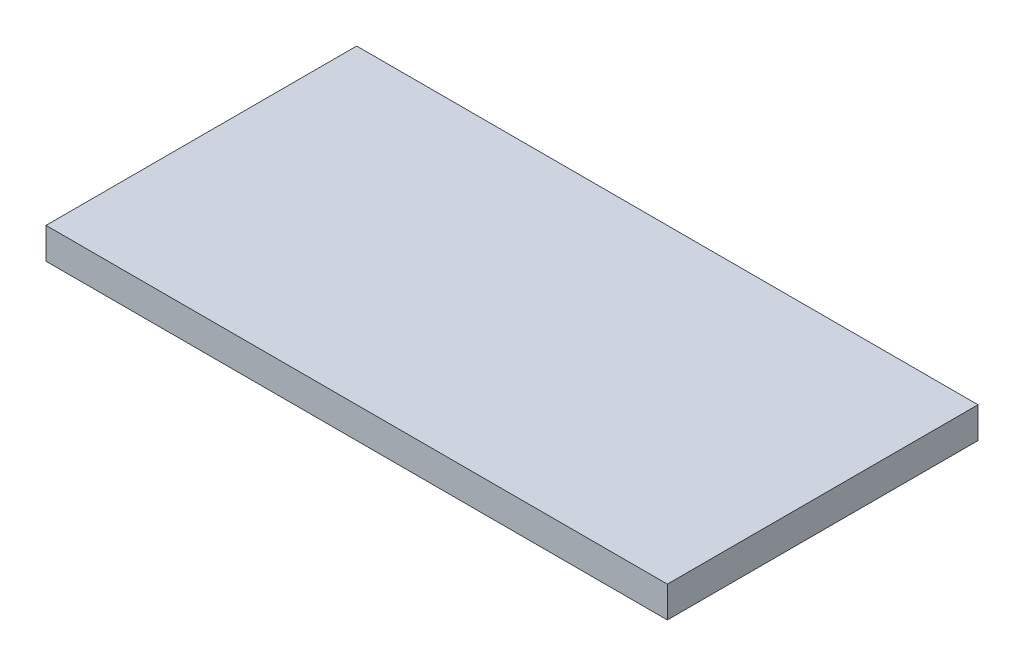
from build123d import *

# Parameters (mm, degrees)
SKETCH1_W           = 2000
SKETCH1_H           = 1000
BOSS_EXTRUDE1_DEPTH = 100
SKETCH2_R           = 63.805939075
CUT_EXTRUDE2_DEPTH  = 50


with BuildPart() as part:
    # Sketch1 → Boss-Extrude1 (new body)
    with BuildSketch(Plane(origin=(0, 0, 0), x_dir=(1, 0, 0), z_dir=(0, 1, 0))):
        Rectangle(SKETCH1_W, SKETCH1_H)
    extrude(amount=BOSS_EXTRUDE1_DEPTH)

    # Sketch2 → Cut-Extrude2 (cut, symmetric)
    with BuildSketch(Plane.XZ):
        with Locations(Location((-900, 400, 0), (0, 0, 270))):
            Circle(SKETCH2_R)
    extrude(amount=CUT_EXTRUDE2_DEPTH, both=True, mode=Mode.SUBTRACT)


solid = part.part
